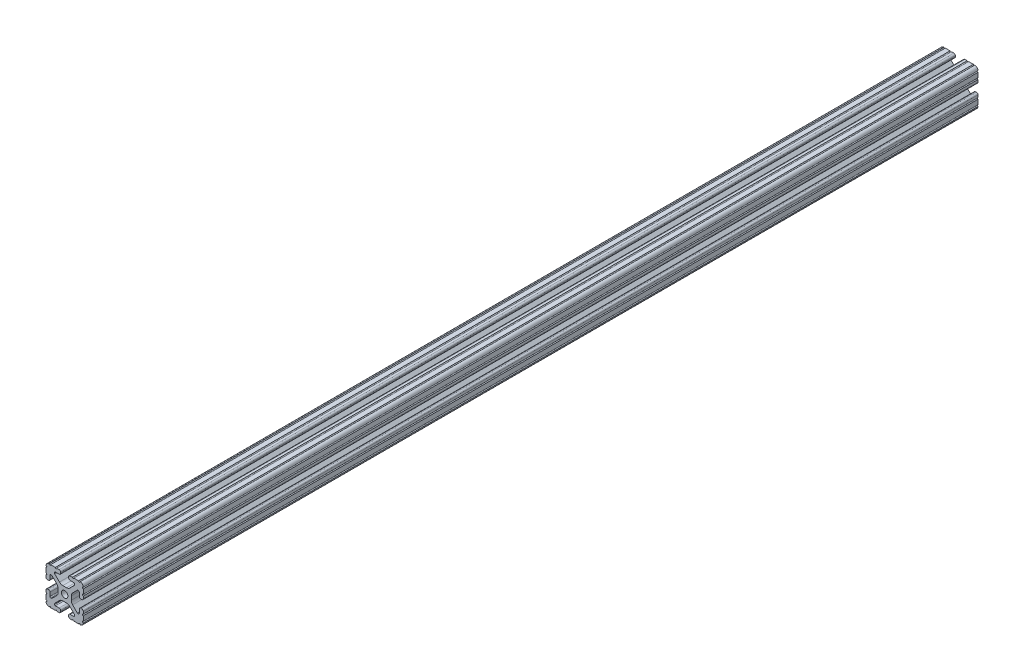
from build123d import *

# Parameters (mm, degrees)
SKETCH1_R      = 3.3274
EXTRUDE1_DEPTH = 914.4


with BuildPart() as part:
    # Sketch1 → Extrude1 (new body)
    with BuildSketch(Plane.XY):
        with BuildLine():
            Line((-10.022898969, 12.91475973), (-5.252158105, 8.144007132))
            ThreePointArc((-5.252158105, 8.144007132), (-3.715177372, 7.117027388), (-1.902183975, 6.7564))
            Line((-1.902183975, 6.7564), (1.902183975, 6.7564))
            ThreePointArc((1.902183975, 6.7564), (3.715177372, 7.117027388), (5.252158105, 8.144007132))
            Line((5.252158105, 8.144007132), (10.022898969, 12.91475973))
            ThreePointArc((10.022898969, 12.91475973), (10.218362387, 13.207291992), (10.287, 13.552357131))
            Line((10.287, 13.552357131), (10.287, 14.0843))
            ThreePointArc((10.287, 14.0843), (10.022898185, 14.721898185), (9.3853, 14.986))
            Line((9.3853, 14.986), (5.617617549, 14.986))
            ThreePointArc((5.617617549, 14.986), (4.519044045, 15.441044045), (4.064, 16.539617549))
            Line((4.064, 16.539617549), (4.064, 17.496382451))
            ThreePointArc((4.064, 17.496382451), (4.519044045, 18.594955955), (5.617617549, 19.05))
            Line((5.617617549, 19.05), (7.974178704, 19.05))
            ThreePointArc((7.974178704, 19.05), (8.736178704, 18.288), (9.498178704, 19.05))
            Line((9.498178704, 19.05), (14.327719207, 19.05))
            ThreePointArc((14.327719207, 19.05), (15.087603123, 18.231251131), (15.847487039, 19.05))
            ThreePointArc((15.847487039, 19.05), (18.120176289, 18.120192083), (19.05, 15.847509295))
            ThreePointArc((19.05, 15.847509295), (18.231250992, 15.08762539), (19.05, 14.327741484))
            Line((19.05, 14.327741484), (19.05, 9.496091471))
            ThreePointArc((19.05, 9.496091471), (18.231250992, 8.736207565), (19.05, 7.97632366))
            Line((19.05, 7.97632366), (19.05, 5.617617549))
            ThreePointArc((19.05, 5.617617549), (18.594955955, 4.519044045), (17.496382451, 4.064))
            Line((17.496382451, 4.064), (16.539617549, 4.064))
            ThreePointArc((16.539617549, 4.064), (15.441044045, 4.519044045), (14.986, 5.617617549))
            Line((14.986, 5.617617549), (14.986, 9.385342516))
            ThreePointArc((14.986, 9.385342516), (14.721898185, 10.022940701), (14.0843, 10.287042516))
            Line((14.0843, 10.287042516), (13.516042086, 10.287042516))
            ThreePointArc((13.516042086, 10.287042516), (13.170975923, 10.218404478), (12.878443117, 10.022939917))
            Line((12.878443117, 10.022939917), (8.14758008, 5.292065243))
            ThreePointArc((8.14758008, 5.292065243), (7.117955879, 3.751120653), (6.7564, 1.933453584))
            Line((6.7564, 1.933453584), (6.7564, -1.933453584))
            ThreePointArc((6.7564, -1.933453584), (7.117955879, -3.751120653), (8.14758008, -5.292065243))
            Line((8.14758008, -5.292065243), (12.878443117, -10.022939917))
            ThreePointArc((12.878443117, -10.022939917), (13.170975923, -10.218404478), (13.516042086, -10.287042516))
            Line((13.516042086, -10.287042516), (14.0843, -10.287042516))
            ThreePointArc((14.0843, -10.287042516), (14.721898185, -10.022940701), (14.986, -9.385342516))
            Line((14.986, -9.385342516), (14.986, -5.617617549))
            ThreePointArc((14.986, -5.617617549), (15.441044045, -4.519044045), (16.539617549, -4.064))
            Line((16.539617549, -4.064), (17.496382451, -4.064))
            ThreePointArc((17.496382451, -4.064), (18.594955955, -4.519044045), (19.05, -5.617617549))
            Line((19.05, -5.617617549), (19.05, -7.976318491))
            ThreePointArc((19.05, -7.976318491), (18.231250992, -8.736202396), (19.05, -9.496086302))
            Line((19.05, -9.496086302), (19.05, -14.32774291))
            ThreePointArc((19.05, -14.32774291), (18.231250992, -15.087626816), (19.05, -15.847510721))
            ThreePointArc((19.05, -15.847510721), (18.120175716, -18.120192644), (15.847486868, -19.05))
            ThreePointArc((15.847486868, -19.05), (15.087602952, -18.231251131), (14.327719036, -19.05))
            Line((14.327719036, -19.05), (9.496062448, -19.05))
            ThreePointArc((9.496062448, -19.05), (8.736178532, -18.231251131), (7.976294616, -19.05))
            Line((7.976294616, -19.05), (5.617617549, -19.05))
            ThreePointArc((5.617617549, -19.05), (4.519044045, -18.594955955), (4.064, -17.496382451))
            Line((4.064, -17.496382451), (4.064, -16.539617549))
            ThreePointArc((4.064, -16.539617549), (4.519044045, -15.441044045), (5.617617549, -14.986))
            Line((5.617617549, -14.986), (9.3853, -14.986))
            ThreePointArc((9.3853, -14.986), (10.022898185, -14.721898185), (10.287, -14.0843))
            Line((10.287, -14.0843), (10.287, -13.552357131))
            ThreePointArc((10.287, -13.552357131), (10.218362387, -13.207291992), (10.022898969, -12.91475973))
            Line((10.022898969, -12.91475973), (5.252158105, -8.144007132))
            ThreePointArc((5.252158105, -8.144007132), (3.715177372, -7.117027388), (1.902183975, -6.7564))
            Line((1.902183975, -6.7564), (-1.902183975, -6.7564))
            ThreePointArc((-1.902183975, -6.7564), (-3.715177372, -7.117027388), (-5.252158105, -8.144007132))
            Line((-5.252158105, -8.144007132), (-10.022898969, -12.91475973))
            ThreePointArc((-10.022898969, -12.91475973), (-10.218362387, -13.207291992), (-10.287, -13.552357131))
            Line((-10.287, -13.552357131), (-10.287, -14.0843))
            ThreePointArc((-10.287, -14.0843), (-10.022898185, -14.721898185), (-9.3853, -14.986))
            Line((-9.3853, -14.986), (-5.617617549, -14.986))
            ThreePointArc((-5.617617549, -14.986), (-4.519044045, -15.441044045), (-4.064, -16.539617549))
            Line((-4.064, -16.539617549), (-4.064, -17.496382451))
            ThreePointArc((-4.064, -17.496382451), (-4.519044045, -18.594955955), (-5.617617549, -19.05))
            Line((-5.617617549, -19.05), (-7.976294616, -19.05))
            ThreePointArc((-7.976294616, -19.05), (-8.736178532, -18.231251131), (-9.496062448, -19.05))
            Line((-9.496062448, -19.05), (-14.327719036, -19.05))
            ThreePointArc((-14.327719036, -19.05), (-15.087602952, -18.231251131), (-15.847486868, -19.05))
            ThreePointArc((-15.847486868, -19.05), (-18.120175716, -18.120192644), (-19.05, -15.847510721))
            ThreePointArc((-19.05, -15.847510721), (-18.231250992, -15.087626816), (-19.05, -14.32774291))
            Line((-19.05, -14.32774291), (-19.05, -9.496086302))
            ThreePointArc((-19.05, -9.496086302), (-18.231250992, -8.736202396), (-19.05, -7.976318491))
            Line((-19.05, -7.976318491), (-19.05, -5.617617549))
            ThreePointArc((-19.05, -5.617617549), (-18.594955955, -4.519044045), (-17.496382451, -4.064))
            Line((-17.496382451, -4.064), (-16.539617549, -4.064))
            ThreePointArc((-16.539617549, -4.064), (-15.441044045, -4.519044045), (-14.986, -5.617617549))
            Line((-14.986, -5.617617549), (-14.986, -9.385342516))
            ThreePointArc((-14.986, -9.385342516), (-14.721898185, -10.022940701), (-14.0843, -10.287042516))
            Line((-14.0843, -10.287042516), (-13.516042086, -10.287042516))
            ThreePointArc((-13.516042086, -10.287042516), (-13.170975923, -10.218404478), (-12.878443117, -10.022939917))
            Line((-12.878443117, -10.022939917), (-8.14758008, -5.292065243))
            ThreePointArc((-8.14758008, -5.292065243), (-7.117955879, -3.751120653), (-6.7564, -1.933453584))
            Line((-6.7564, -1.933453584), (-6.7564, 1.933453584))
            ThreePointArc((-6.7564, 1.933453584), (-7.117955879, 3.751120653), (-8.14758008, 5.292065243))
            Line((-8.14758008, 5.292065243), (-12.878443117, 10.022939917))
            ThreePointArc((-12.878443117, 10.022939917), (-13.170975923, 10.218404478), (-13.516042086, 10.287042516))
            Line((-13.516042086, 10.287042516), (-14.0843, 10.287042516))
            ThreePointArc((-14.0843, 10.287042516), (-14.721898185, 10.022940701), (-14.986, 9.385342516))
            Line((-14.986, 9.385342516), (-14.986, 5.617617549))
            ThreePointArc((-14.986, 5.617617549), (-15.441044045, 4.519044045), (-16.539617549, 4.064))
            Line((-16.539617549, 4.064), (-17.496382451, 4.064))
            ThreePointArc((-17.496382451, 4.064), (-18.594955955, 4.519044045), (-19.05, 5.617617549))
            Line((-19.05, 5.617617549), (-19.05, 7.97632366))
            ThreePointArc((-19.05, 7.97632366), (-18.231250992, 8.736207565), (-19.05, 9.496091471))
            Line((-19.05, 9.496091471), (-19.05, 14.327741484))
            ThreePointArc((-19.05, 14.327741484), (-18.231250992, 15.08762539), (-19.05, 15.847509295))
            ThreePointArc((-19.05, 15.847509295), (-18.120176289, 18.120192083), (-15.847487039, 19.05))
            ThreePointArc((-15.847487039, 19.05), (-15.087603123, 18.231251131), (-14.327719207, 19.05))
            Line((-14.327719207, 19.05), (-9.498178704, 19.05))
            ThreePointArc((-9.498178704, 19.05), (-8.736178704, 18.288), (-7.974178704, 19.05))
            Line((-7.974178704, 19.05), (-5.617617549, 19.05))
            ThreePointArc((-5.617617549, 19.05), (-4.519044045, 18.594955955), (-4.064, 17.496382451))
            Line((-4.064, 17.496382451), (-4.064, 16.539617549))
            ThreePointArc((-4.064, 16.539617549), (-4.519044045, 15.441044045), (-5.617617549, 14.986))
            Line((-5.617617549, 14.986), (-9.3853, 14.986))
            ThreePointArc((-9.3853, 14.986), (-10.022898185, 14.721898185), (-10.287, 14.0843))
            Line((-10.287, 14.0843), (-10.287, 13.552357131))
            ThreePointArc((-10.287, 13.552357131), (-10.218362387, 13.207291992), (-10.022898969, 12.91475973))
        make_face()
        Circle(SKETCH1_R, mode=Mode.SUBTRACT)
    extrude(amount=-EXTRUDE1_DEPTH)


solid = part.part
